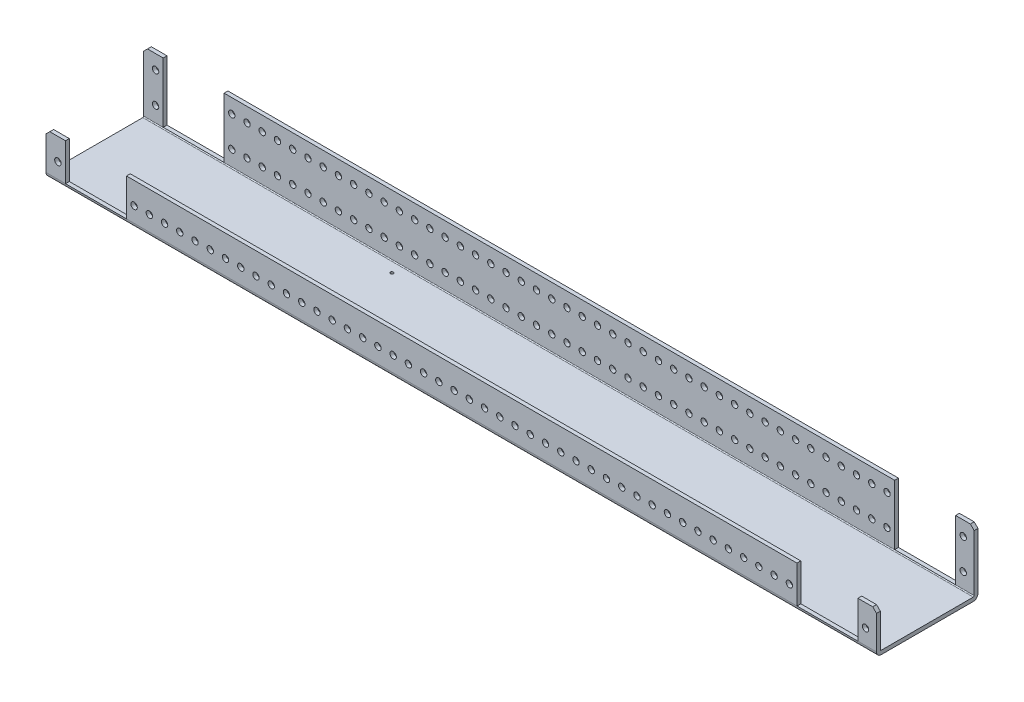
from build123d import *

# Parameters (mm, degrees)
SKETCH1_W               = 692.15
SKETCH1_H               = 84.582
BOSS_EXTRUDE1_DEPTH     = 53.975
SKETCH2_W               = 84.582
SKETCH2_H               = 50.8
CUT_EXTRUDE1_DEPTH      = 700.38475666
SKETCH3_W               = 692.15
SKETCH3_H               = 3.175
BOSS_EXTRUDE2_DEPTH     = 31.75
M2_CLEARANCE_HOLE1_D    = 2.54
M5_CLEARANCE_HOLE2_D    = 5.334
CHAMFER1_SIZE           = 3.175
FILLET1_R               = 0.762
FILLET2_R               = 3.937
CUT_EXTRUDE7_DEPTH      = 58.674
CUT_EXTRUDE7_DEPTH_BACK = 182.626
CUT_EXTRUDE8_DEPTH      = 66.802
CUT_EXTRUDE8_DEPTH_BACK = 191.516


with BuildPart() as part:
    # Sketch1 → Boss-Extrude1 (new body)
    with BuildSketch(Plane(origin=(0, 53.975, 0), x_dir=(1, 0, 0), z_dir=(0, 1, 0))):
        with Locations((346.075, 42.291)):
            Rectangle(SKETCH1_W, SKETCH1_H)
    extrude(amount=-BOSS_EXTRUDE1_DEPTH)

    # Sketch2 → Cut-Extrude1 (cut, through all)
    with BuildSketch(Plane(origin=(692.15, 0, 0), x_dir=(0, 0, -1), z_dir=(1, 0, 0))):
        with Locations((39.116, 28.575)):
            Rectangle(SKETCH2_W, SKETCH2_H)
    extrude(amount=-CUT_EXTRUDE1_DEPTH, mode=Mode.SUBTRACT)

    # Sketch3 → Boss-Extrude2 (add)
    with BuildSketch(Plane(origin=(0, 3.175, 0), x_dir=(-1, 0, 0), z_dir=(0, 1, 0))):
        with Locations((-346.075, -1.5875)):
            Rectangle(SKETCH3_W, SKETCH3_H)
    extrude(amount=BOSS_EXTRUDE2_DEPTH)

    # M2 Clearance Hole1 (through all)
    with Locations(Plane(origin=(0, 3.175, 0), x_dir=(1, 0, 0), z_dir=(0, 1, 0))):
        with Locations((215.9, 5.842), (215.9, 72.39)):
            Hole(M2_CLEARANCE_HOLE1_D / 2)

    # M5 Clearance Hole2 (through all)
    with Locations(Plane(origin=(0, 0, -84.582), x_dir=(-1, 0, 0), z_dir=(0, 0, -1))):
        with Locations((2.794, 16.637), (-9.906, 16.637), (-22.606, 16.637), (-35.306, 16.637), (-48.006, 16.637), (-60.706, 16.637), (-73.406, 16.637), (-86.106, 16.637), (-98.806, 16.637), (-111.506, 16.637), (-9.906, 42.037), (-22.606, 42.037), (-35.306, 42.037), (-48.006, 42.037), (-60.706, 42.037), (-73.406, 42.037), (-86.106, 42.037), (-98.806, 42.037), (-111.506, 42.037), (2.794, 42.037), (-124.206, 16.637), (-136.906, 16.637), (-149.606, 16.637), (-162.306, 16.637), (-175.006, 16.637), (-187.706, 16.637), (-200.406, 16.637), (-213.106, 16.637), (-225.806, 16.637), (-238.506, 16.637), (-251.206, 16.637), (-263.906, 16.637), (-276.606, 16.637), (-289.306, 16.637), (-302.006, 16.637), (-314.706, 16.637), (-327.406, 16.637), (-340.106, 16.637), (-352.806, 16.637), (-365.506, 16.637), (-378.206, 16.637), (-390.906, 16.637), (-403.606, 16.637), (-416.306, 16.637), (-429.006, 16.637), (-441.706, 16.637), (-454.406, 16.637), (-467.106, 16.637), (-479.806, 16.637), (-492.506, 16.637), (-505.206, 16.637), (-517.906, 16.637), (-530.606, 16.637), (-543.306, 16.637), (-556.006, 16.637), (-568.706, 16.637), (-581.406, 16.637), (-594.106, 16.637), (-606.806, 16.637), (-619.506, 16.637), (-632.206, 16.637), (-644.906, 16.637), (-657.606, 16.637), (-670.306, 16.637), (-683.006, 16.637), (-695.706, 16.637), (-708.406, 16.637), (-721.106, 16.637), (-124.206, 42.037), (-136.906, 42.037), (-149.606, 42.037), (-162.306, 42.037), (-175.006, 42.037), (-187.706, 42.037), (-200.406, 42.037), (-213.106, 42.037), (-225.806, 42.037), (-238.506, 42.037), (-251.206, 42.037), (-263.906, 42.037), (-276.606, 42.037), (-289.306, 42.037), (-302.006, 42.037), (-314.706, 42.037), (-327.406, 42.037), (-340.106, 42.037), (-352.806, 42.037), (-365.506, 42.037), (-378.206, 42.037), (-390.906, 42.037), (-403.606, 42.037), (-416.306, 42.037), (-429.006, 42.037), (-441.706, 42.037), (-454.406, 42.037), (-467.106, 42.037), (-479.806, 42.037), (-492.506, 42.037), (-505.206, 42.037), (-517.906, 42.037), (-530.606, 42.037), (-543.306, 42.037), (-556.006, 42.037), (-568.706, 42.037), (-581.406, 42.037), (-594.106, 42.037), (-606.806, 42.037), (-619.506, 42.037), (-632.206, 42.037), (-644.906, 42.037), (-657.606, 42.037), (-670.306, 42.037), (-683.006, 42.037), (-695.706, 42.037), (-708.406, 42.037), (-721.106, 42.037)):
            Hole(M5_CLEARANCE_HOLE2_D / 2)

    # Chamfer1
    chamfer1_edges = [part.edges().sort_by_distance(p)[0] for p in [
        (692.15, 53.975, -82.9945),
        (0, 34.925, -1.5875),
        (692.15, 34.925, -1.5875),
        (0, 53.975, -82.9945),
    ]]
    chamfer(chamfer1_edges, length=CHAMFER1_SIZE)

    # Fillet1
    fillet1_edges = [part.edges().sort_by_distance(p)[0] for p in [
        (346.075, 3.175, -81.407),
        (346.075, 3.175, -3.175),
    ]]
    fillet(fillet1_edges, radius=FILLET1_R)

    # Fillet2
    fillet2_edges = [part.edges().sort_by_distance(p)[0] for p in [
        (346.075, 0, 0),
        (346.075, 0, -84.582),
    ]]
    fillet(fillet2_edges, radius=FILLET2_R)

    # Sketch15 → Cut-Extrude7 (cut, two sides: drawn at the far end of the back side and taken through both)
    with BuildSketch(Plane(origin=(0, 0, -84.582), x_dir=(-1, 0, 0), z_dir=(0, 0, -1)).offset(-CUT_EXTRUDE7_DEPTH_BACK)):
        Polygon((-16.256, 27.686), (-16.256, 53.975), (-67.056, 53.975), (-67.056, 3.937), (-16.256, 3.937), align=None)
    extrude(amount=CUT_EXTRUDE7_DEPTH + CUT_EXTRUDE7_DEPTH_BACK, mode=Mode.SUBTRACT)

    # Sketch16 → Cut-Extrude8 (cut, two sides: drawn at the far end of the back side and taken through both)
    with BuildSketch(Plane(origin=(0, 0, -84.582), x_dir=(-1, 0, 0), z_dir=(0, 0, -1)).offset(-CUT_EXTRUDE8_DEPTH_BACK)):
        Polygon((-676.656, 27.3685), (-676.656, 3.937), (-625.856, 3.937), (-625.856, 53.975), (-676.656, 53.975), align=None)
    extrude(amount=CUT_EXTRUDE8_DEPTH + CUT_EXTRUDE8_DEPTH_BACK, mode=Mode.SUBTRACT)


solid = part.part
